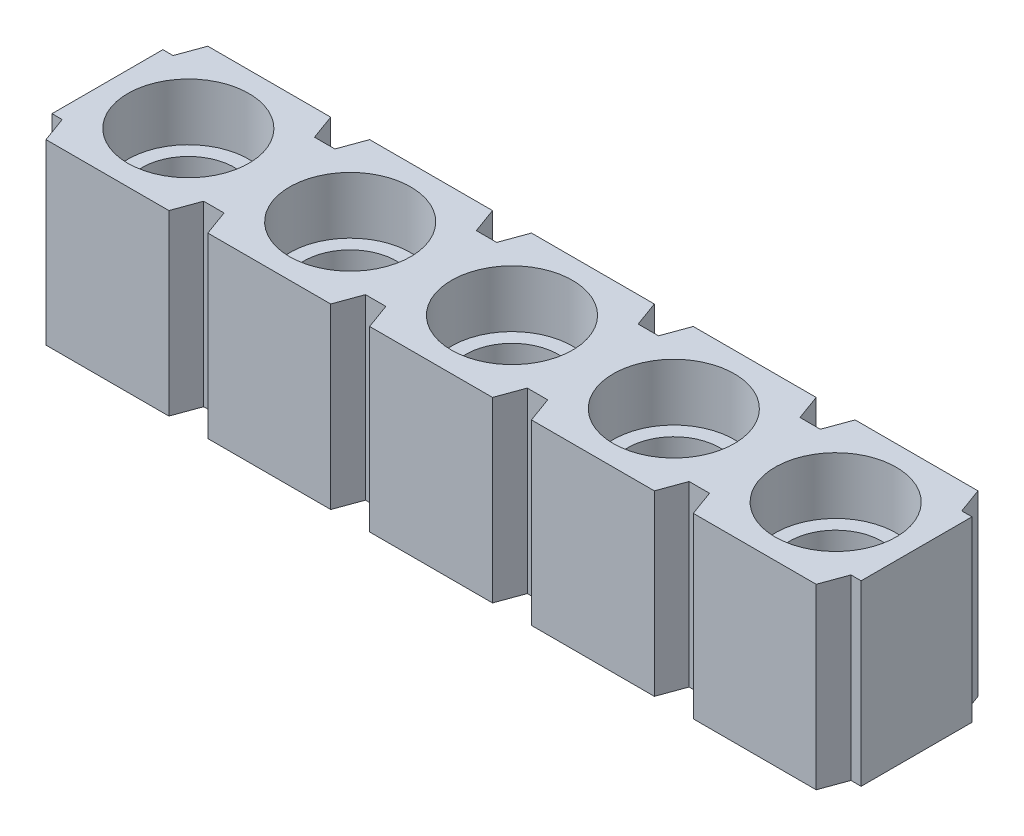
from build123d import *

# Parameters (mm, degrees)
EXTRUDE1_DEPTH    = 2.794
HOLE1_D           = 1.45034
HOLE1_CBORE_D     = 1.89992
HOLE1_CBORE_DEPTH = 0.89408
EXTRUDE2_DEPTH    = 2.794
LPATTERN1_COUNT   = 5
LPATTERN1_PITCH   = 2.54
LPATTERN2_COUNT   = 63
LPATTERN2_PITCH   = 2.54


with BuildPart() as part:
    # Sketch1 → Extrude1 (new body)
    with BuildSketch(Plane(origin=(0, 0, 0), x_dir=(1, 0, 0), z_dir=(0, 1, 0))):
        Polygon((12.394373708, 0.40005), (12.234353708, 0.40005), (12.088747416, 0), (0, 0), (-0.145606292, 0.40005), (-0.305626292, 0.40005), (-0.305626292, 2.13995), (-0.145606292, 2.13995), (0, 2.54), (12.088747416, 2.54), (12.234353708, 2.13995), (12.394373708, 2.13995), align=None)
    extrude(amount=-EXTRUDE1_DEPTH)

    # Hole1 (through all)
    with Locations(Plane(origin=(0.964373708, 0, -1.27), x_dir=(0, 0, 1), z_dir=(0, 1, 0))):
        with Locations((0, 0)):
            hole1 = CounterBoreHole(HOLE1_D / 2, HOLE1_CBORE_D / 2, HOLE1_CBORE_DEPTH)

    # Sketch4 → Extrude2 (cut)
    with BuildSketch(Plane(origin=(0, 0, 0), x_dir=(1, 0, 0), z_dir=(0, 1, 0))):
        Polygon((1.928772816, 0), (2.5399746, 0), (2.394368308, 0.40005), (2.074379108, 0.40005), align=None)
        Polygon((2.074379108, 2.13995), (2.394368308, 2.13995), (2.5399746, 2.54), (1.928772816, 2.54), align=None)
    extrude2 = extrude(amount=-EXTRUDE2_DEPTH, mode=Mode.SUBTRACT)

    # LPattern1: Hole1 ×5
    with Locations(*[(i * LPATTERN1_PITCH, 0, 0) for i in range(1, LPATTERN1_COUNT)]):
        add(hole1, mode=Mode.SUBTRACT)

    # LPattern2: Extrude2 ×63
    with Locations(*[(i * LPATTERN2_PITCH, 0, 0) for i in range(1, LPATTERN2_COUNT)]):
        add(extrude2, mode=Mode.SUBTRACT)


solid = part.part
